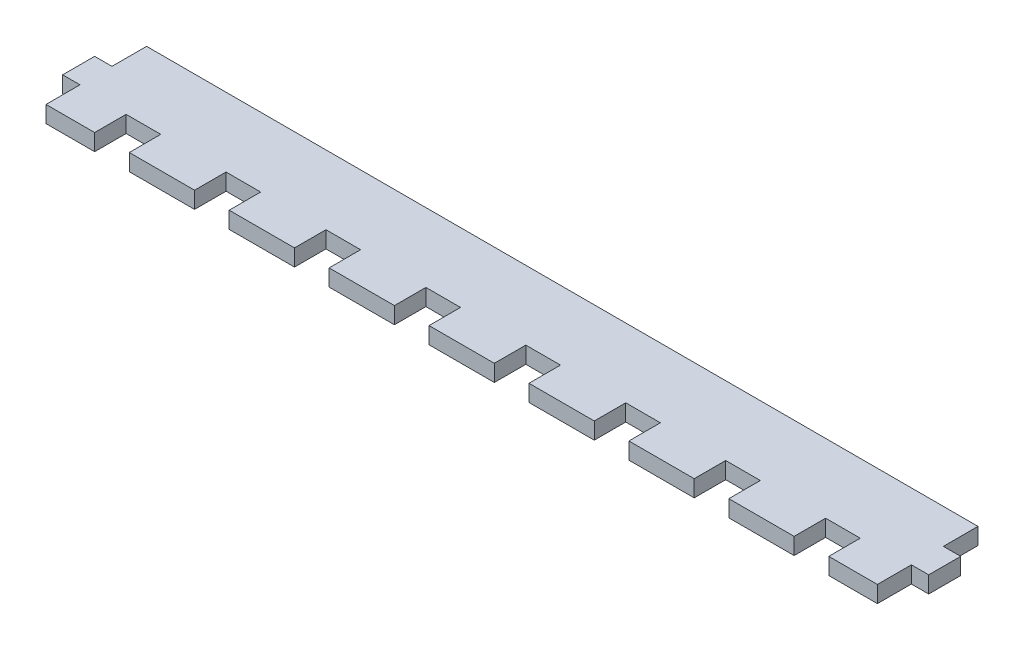
from build123d import *

# Parameters (mm, degrees)
SKETCH1_W           = 330.2
SKETCH1_H           = 57.15
BOSS_EXTRUDE1_DEPTH = 6.35
SKETCH3_W           = 24.892
SKETCH3_H           = 12
BOSS_EXTRUDE2_DEPTH = 6.35
SKETCH4_W           = 13.208
SKETCH4_H           = 13.208
CUT_EXTRUDE2_DEPTH  = 171.131311419
SKETCH5_W           = 365.344823274
SKETCH5_H           = 36.987593387
CUT_EXTRUDE3_DEPTH  = 30.796


with BuildPart() as part:
    # Sketch1 → Boss-Extrude1 (new body)
    with BuildSketch(Plane(origin=(0, 0, 0), x_dir=(1, 0, 0), z_dir=(0, 1, 0))):
        Rectangle(SKETCH1_W, SKETCH1_H)
    extrude(amount=BOSS_EXTRUDE1_DEPTH)

    # Sketch3 → Boss-Extrude2 (add)
    with BuildSketch(Plane(origin=(0, 0, 0), x_dir=(1, 0, 0), z_dir=(0, 1, 0))):
        with Locations((-114.3, -34.575)):
            Rectangle(SKETCH3_W, SKETCH3_H)
        with Locations((-76.2, -34.575)):
            Rectangle(SKETCH3_W, SKETCH3_H)
        with Locations((-38.1, -34.575)):
            Rectangle(SKETCH3_W, SKETCH3_H)
        with Locations((0, -34.575)):
            Rectangle(SKETCH3_W, SKETCH3_H)
        with Locations((38.1, -34.575)):
            Rectangle(SKETCH3_W, SKETCH3_H)
        with Locations((76.2, -34.575)):
            Rectangle(SKETCH3_W, SKETCH3_H)
        with Locations((114.3, -34.575)):
            Rectangle(SKETCH3_W, SKETCH3_H)
        with Locations((152.4, -34.575)):
            Rectangle(SKETCH3_W, SKETCH3_H)
        with Locations((-152.4, -34.575)):
            Rectangle(SKETCH3_W, SKETCH3_H)
    extrude(amount=BOSS_EXTRUDE2_DEPTH)

    # Sketch4 → Cut-Extrude2 (cut, through all)
    with BuildSketch(Plane(origin=(0, 0, 0), x_dir=(1, 0, 0), z_dir=(0, 1, 0))):
        with Locations((165.1, 16.575)):
            Rectangle(SKETCH4_W, SKETCH4_H)
        with Locations((-165.1, -34.225)):
            Rectangle(SKETCH4_W, SKETCH4_H)
        with Locations((165.1, -8.825)):
            Rectangle(SKETCH4_W, SKETCH4_H)
        with Locations((165.1, -34.225)):
            Rectangle(SKETCH4_W, SKETCH4_H)
        with Locations((-165.1, -8.825)):
            Rectangle(SKETCH4_W, SKETCH4_H)
        with Locations((-165.1, 16.575)):
            Rectangle(SKETCH4_W, SKETCH4_H)
    extrude(amount=CUT_EXTRUDE2_DEPTH, mode=Mode.SUBTRACT)

    # Sketch5 → Cut-Extrude3 (cut)
    with BuildSketch(Plane(origin=(0, 0, -28.575), x_dir=(-1, 0, 0), z_dir=(0, 0, -1))):
        with Locations((-4.838573854, 1.285089719)):
            Rectangle(SKETCH5_W, SKETCH5_H)
    extrude(amount=-CUT_EXTRUDE3_DEPTH, mode=Mode.SUBTRACT)


solid = part.part
